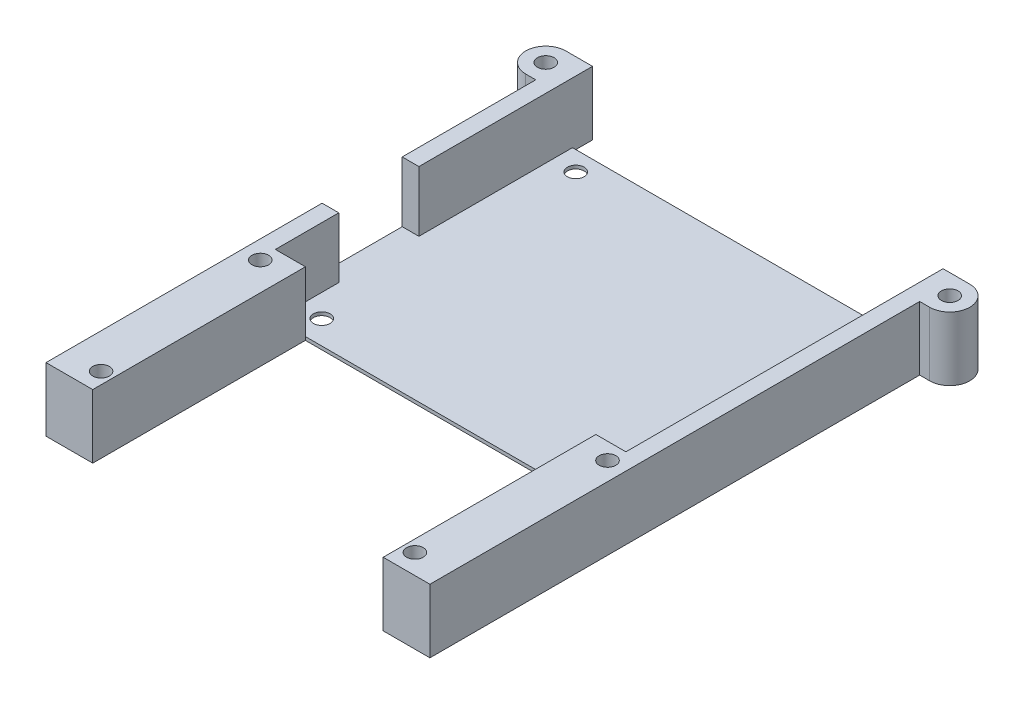
from build123d import *

# Parameters (mm, degrees)
BOSS_EXTRUDE1_DEPTH            = 0.5
BOSS_EXTRUDE2_DEPTH            = 9.55
F_2_5_2_5_DIAMETER_HOLE1_D     = 2.5
F_2_5_2_5_DIAMETER_HOLE1_DEPTH = 12
F_2_5_2_5_DIAMETER_HOLE1_TIP   = 0.751075774


with BuildPart() as part:
    # Sketch1 → Boss-Extrude1 (new body)
    with BuildSketch(Plane(origin=(0, 0, 0), x_dir=(1, 0, 0), z_dir=(0, 1, 0))):
        Polygon((26.25, 31.85), (26.25, 76.35), (-26.25, 76.35), (-26.25, 53.35), (-28.75, 53.35), (-28.75, 41.35), (-26.25, 41.35), (-26.25, 31.85), align=None)
    extrude(amount=BOSS_EXTRUDE1_DEPTH)

    # Sketch1<3> → Boss-Extrude2 (add)
    with BuildSketch(Plane(origin=(0, 0, 0), x_dir=(1, 0, 0), z_dir=(0, 1, 0))):
        with BuildLine():
            Line((-26.25, 79.35), (-30.25, 79.35))
            ThreePointArc((-30.25, 79.35), (-33.25, 76.35), (-30.25, 73.35))
            Line((-30.25, 73.35), (-28.75, 73.35))
            Line((-28.75, 73.35), (-28.75, 53.35))
            Line((-28.75, 53.35), (-26.25, 53.35))
            Line((-26.25, 53.35), (-26.25, 79.35))
        make_face()
        with BuildLine():
            Line((26.25, 79.35), (26.25, 31.85))
            Line((26.25, 31.85), (21.75, 31.85))
            Line((21.75, 31.85), (21.75, 0))
            Line((21.75, 0), (28.75, 0))
            Line((28.75, 0), (28.75, 73.35))
            Line((28.75, 73.35), (30.25, 73.35))
            ThreePointArc((30.25, 73.35), (33.25, 76.35), (30.25, 79.35))
            Line((30.25, 79.35), (26.25, 79.35))
        make_face()
        Polygon((-26.25, 31.85), (-26.25, 41.35), (-28.75, 41.35), (-28.75, 0), (-21.75, 0), (-21.75, 31.85), align=None)
    extrude(amount=BOSS_EXTRUDE2_DEPTH)

    # Ø2.5 (2.5) Diameter Hole1
    with Locations(Plane(origin=(0, 0, 0), x_dir=(-1, 0, 0), z_dir=(0, -1, 0))):
        with Locations((-22.85, 73.45), (22.85, 73.45), (26, 29.35), (22.85, 35.4), (-22.85, 35.4), (-26, 29.35), (-23.5, 3), (23.5, 3), (-30.25, 76.35), (30.25, 76.35)):
            Hole(F_2_5_2_5_DIAMETER_HOLE1_D / 2, depth=F_2_5_2_5_DIAMETER_HOLE1_DEPTH)
            with Locations((0, 0, -(F_2_5_2_5_DIAMETER_HOLE1_DEPTH + F_2_5_2_5_DIAMETER_HOLE1_TIP / 2))):  # 118° drill point
                Cone(0, F_2_5_2_5_DIAMETER_HOLE1_D / 2, F_2_5_2_5_DIAMETER_HOLE1_TIP, mode=Mode.SUBTRACT)


solid = part.part
